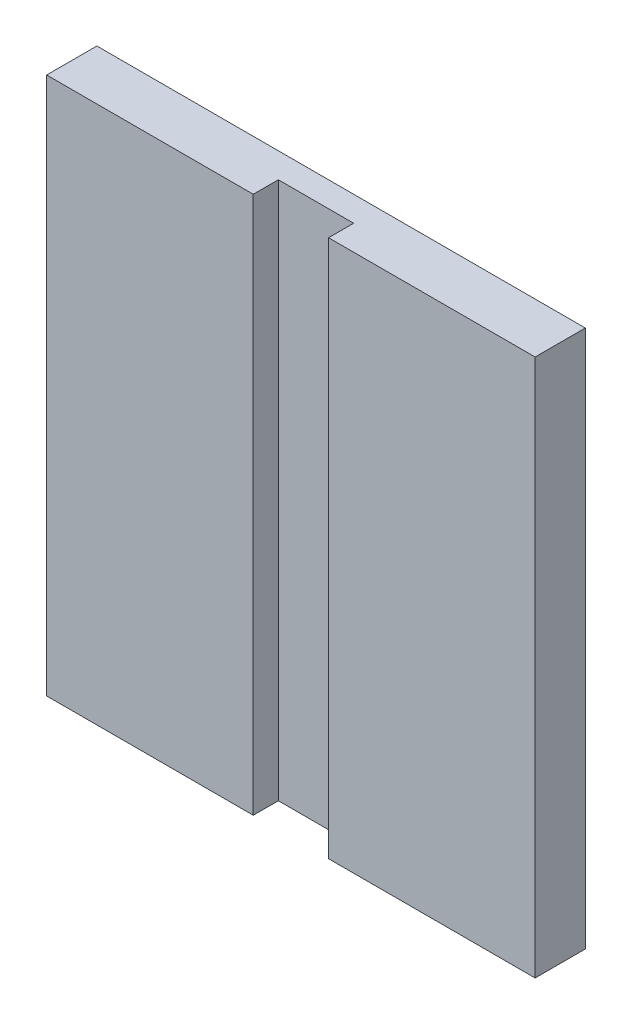
from build123d import *

# Parameters (mm, degrees)
SKETCH1_W           = 97.297641781
SKETCH1_H           = 107.127995433
BOSS_EXTRUDE2_DEPTH = 10
SKETCH2_W           = 15
SKETCH2_H           = 107.127995433
CUT_EXTRUDE1_DEPTH  = 5


with BuildPart() as part:
    # Sketch1 → Boss-Extrude2 (new body)
    with BuildSketch(Plane.XY):
        with Locations((-1.594600756, -6.883630768)):
            Rectangle(SKETCH1_W, SKETCH1_H)
    extrude(amount=BOSS_EXTRUDE2_DEPTH)

    # Sketch2 → Cut-Extrude1 (cut)
    with BuildSketch(Plane.XY.offset(10)):
        with Locations((-1.594600756, -6.883630768)):
            Rectangle(SKETCH2_W, SKETCH2_H)
    extrude(amount=-CUT_EXTRUDE1_DEPTH, mode=Mode.SUBTRACT)


solid = part.part
